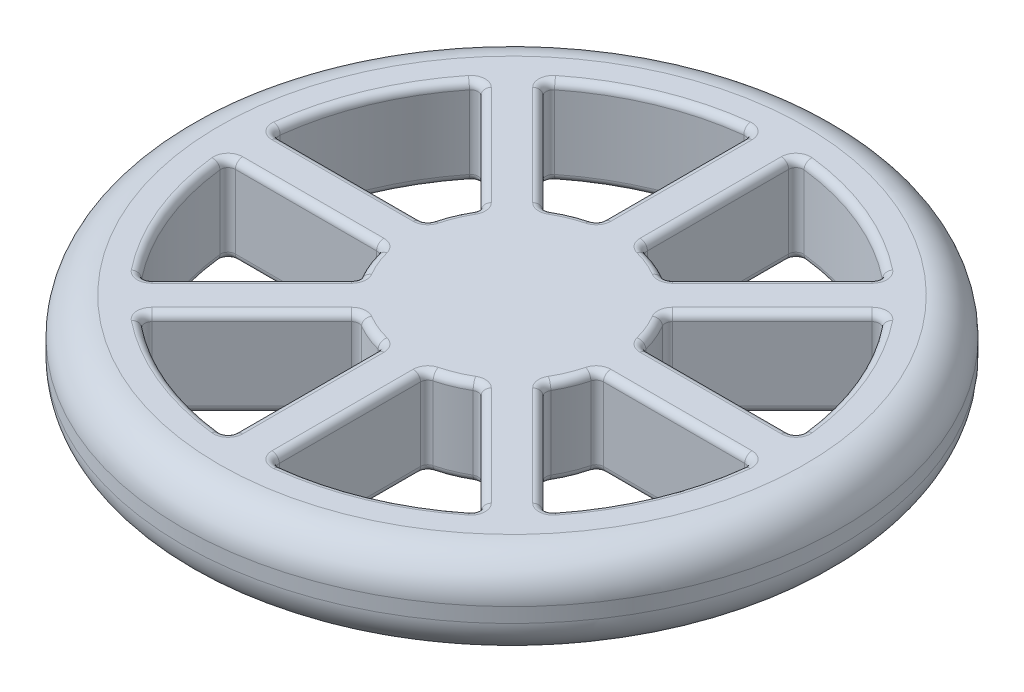
from build123d import *

# Parameters (mm, degrees)
BOSS_EXTRUDE1_DEPTH      = 3
BOSS_EXTRUDE1_DEPTH_BACK = 3
SKETCH1_R                = 22.5
FILLET1_R                = 2.5
CUT_EXTRUDE1_REACH       = 34.381
FILLET2_R                = 0.5
CIRPATTERN1_COUNT        = 8
FILLET2_OF_CIRPATTERN1_R = 0.5


with BuildPart() as part:
    # Sketch1 → Boss-Extrude1 (new, two sides: drawn at the far end of the back side and taken through both)
    with BuildSketch(Plane(origin=(0, 0, 0), x_dir=(1, 0, 0), z_dir=(0, 1, 0)).offset(-BOSS_EXTRUDE1_DEPTH_BACK)):
        Circle(SKETCH1_R)
    extrude(amount=BOSS_EXTRUDE1_DEPTH + BOSS_EXTRUDE1_DEPTH_BACK)

    # Fillet1
    fillet1_edges = [part.edges().sort_by_distance(p)[0] for p in [
        (-22.5, -3, 0),
        (-22.5, 3, 0),
    ]]
    fillet(fillet1_edges, radius=FILLET1_R)

    # Sketch2 → Cut-Extrude1 (cut, up to next)
    with BuildSketch(Plane.XZ.offset(3), mode=Mode.PRIVATE) as cut_extrude1_sk1:
        with BuildLine():
            Line((1.5, 17.937391115), (1.5, 7.348469228))
            ThreePointArc((1.5, 7.348469228), (2.870125743, 6.929096494), (4.135492251, 6.256812594))
            Line((4.135492251, 6.256812594), (11.622990722, 13.744311066))
            ThreePointArc((11.622990722, 13.744311066), (6.888301783, 16.629831585), (1.5, 17.937391115))
        make_face()
    cut_extrude1_tool1 = extrude(cut_extrude1_sk1.sketch, amount=-CUT_EXTRUDE1_REACH, mode=Mode.PRIVATE) & part.part
    cut_extrude1 = cut_extrude1_tool1.solids().sort_by_distance((5.203134, -3, 12.561477))[0]
    add(cut_extrude1, mode=Mode.SUBTRACT)

    # Fillet2
    fillet2_edges = [part.edges().sort_by_distance(p)[0] for p in [
        (1.5, 0, 7.348469228),
        (4.135492251, 0, 6.256812594),
        (11.622990722, 0, 13.744311066),
        (1.5, 0, 17.937391115),
        (1.5, 3, 12.642930172),
        (2.870125743, 3, 6.929096494),
        (6.888301783, 3, 16.629831585),
        (7.879241487, 3, 10.00056183),
        (7.879241487, -3, 10.00056183),
        (2.870125743, -3, 6.929096494),
        (6.888301783, -3, 16.629831585),
        (1.5, -3, 12.642930172),
    ]]
    fillet(fillet2_edges, radius=FILLET2_R)

    # CirPattern1: Cut-Extrude1 ×8 about axis
    cirpattern1_axis = Axis((0, 3, 0), (0, -1, 0))
    for i in range(1, CIRPATTERN1_COUNT):
        add(cut_extrude1.rotate(cirpattern1_axis, i * 360 / CIRPATTERN1_COUNT), mode=Mode.SUBTRACT)

    # Fillet2 of CirPattern1
    fillet2_of_cirpattern1_edges = [part.edges().sort_by_distance(p)[0] for p in [
        (-4.135492251, 0, 6.256812594),
        (-1.5, 0, 7.348469228),
        (-1.5, 0, 17.937391115),
        (-11.622990722, 0, 13.744311066),
        (-7.879241487, 3, 10.00056183),
        (-2.870125743, 3, 6.929096494),
        (-6.888301783, 3, 16.629831585),
        (-1.5, 3, 12.642930172),
        (-1.5, -3, 12.642930172),
        (-2.870125743, -3, 6.929096494),
        (-6.888301783, -3, 16.629831585),
        (-7.879241487, -3, 10.00056183),
        (-7.348469228, 0, 1.5),
        (-6.256812594, 0, 4.135492251),
        (-13.744311066, 0, 11.622990722),
        (-17.937391115, 0, 1.5),
        (-12.642930172, 3, 1.5),
        (-6.929096494, 3, 2.870125743),
        (-16.629831585, 3, 6.888301783),
        (-10.00056183, 3, 7.879241487),
        (-10.00056183, -3, 7.879241487),
        (-6.929096494, -3, 2.870125743),
        (-16.629831585, -3, 6.888301783),
        (-12.642930172, -3, 1.5),
        (-6.256812594, 0, -4.135492251),
        (-7.348469228, 0, -1.5),
        (-17.937391115, 0, -1.5),
        (-13.744311066, 0, -11.622990722),
        (-10.00056183, 3, -7.879241487),
        (-6.929096494, 3, -2.870125743),
        (-16.629831585, 3, -6.888301783),
        (-12.642930172, 3, -1.5),
        (-12.642930172, -3, -1.5),
        (-6.929096494, -3, -2.870125743),
        (-16.629831585, -3, -6.888301783),
        (-10.00056183, -3, -7.879241487),
        (-1.5, 0, -7.348469228),
        (-4.135492251, 0, -6.256812594),
        (-11.622990722, 0, -13.744311066),
        (-1.5, 0, -17.937391115),
        (-1.5, 3, -12.642930172),
        (-2.870125743, 3, -6.929096494),
        (-6.888301783, 3, -16.629831585),
        (-7.879241487, 3, -10.00056183),
        (-7.879241487, -3, -10.00056183),
        (-2.870125743, -3, -6.929096494),
        (-6.888301783, -3, -16.629831585),
        (-1.5, -3, -12.642930172),
        (4.135492251, 0, -6.256812594),
        (1.5, 0, -7.348469228),
        (1.5, 0, -17.937391115),
        (11.622990722, 0, -13.744311066),
        (7.879241487, 3, -10.00056183),
        (2.870125743, 3, -6.929096494),
        (6.888301783, 3, -16.629831585),
        (1.5, 3, -12.642930172),
        (1.5, -3, -12.642930172),
        (2.870125743, -3, -6.929096494),
        (6.888301783, -3, -16.629831585),
        (7.879241487, -3, -10.00056183),
        (7.348469228, 0, -1.5),
        (6.256812594, 0, -4.135492251),
        (13.744311066, 0, -11.622990722),
        (17.937391115, 0, -1.5),
        (12.642930172, 3, -1.5),
        (6.929096494, 3, -2.870125743),
        (16.629831585, 3, -6.888301783),
        (10.00056183, 3, -7.879241487),
        (10.00056183, -3, -7.879241487),
        (6.929096494, -3, -2.870125743),
        (16.629831585, -3, -6.888301783),
        (12.642930172, -3, -1.5),
        (6.256812594, 0, 4.135492251),
        (7.348469228, 0, 1.5),
        (17.937391115, 0, 1.5),
        (13.744311066, 0, 11.622990722),
        (10.00056183, 3, 7.879241487),
        (6.929096494, 3, 2.870125743),
        (16.629831585, 3, 6.888301783),
        (12.642930172, 3, 1.5),
        (12.642930172, -3, 1.5),
        (6.929096494, -3, 2.870125743),
        (16.629831585, -3, 6.888301783),
        (10.00056183, -3, 7.879241487),
    ]]
    fillet(fillet2_of_cirpattern1_edges, radius=FILLET2_OF_CIRPATTERN1_R)


solid = part.part
